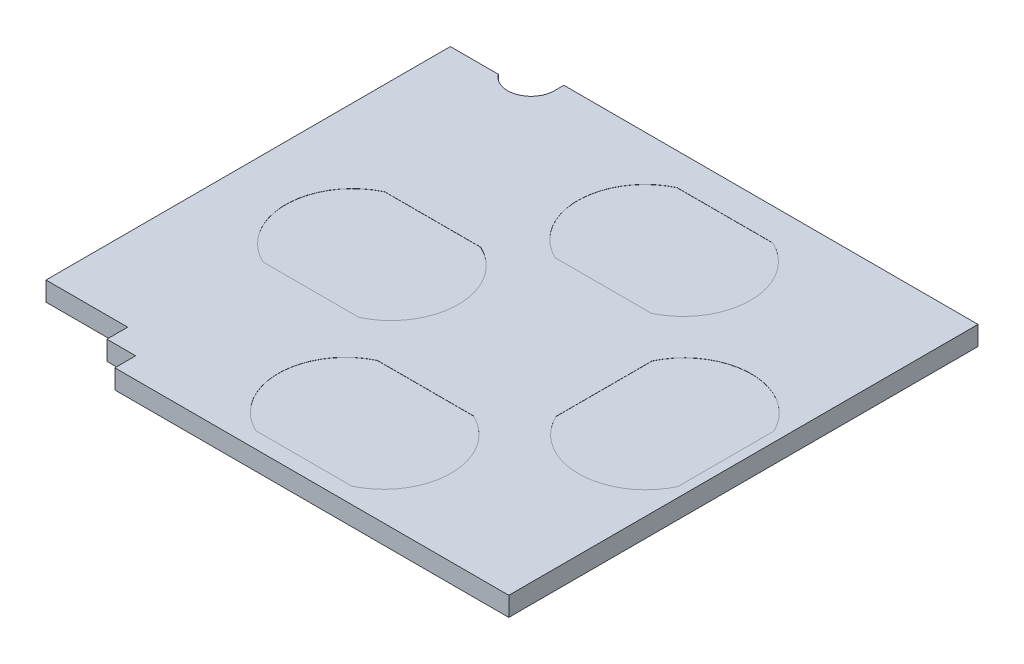
from build123d import *

# Parameters (mm, degrees)
BOSS_EXTRU_1_DEPTH      = 1.2
ENL_V_START             = -1.2
ENL_V_MAT_EXTRU_1_DEPTH = 1.2
ENL_V_MAT_EXTRU_2_DEPTH = 0.01


with BuildPart() as part:
    # Esquisse1 → Boss.-Extru.1 (new body)
    with BuildSketch(Plane(origin=(0, 0, 0), x_dir=(1, 0, 0), z_dir=(0, 1, 0))):
        with BuildLine():
            Line((-15.75, 11.9), (-12.75, 11.9))
            ThreePointArc((-12.75, 11.9), (-10.842060454, 11.495351769), (-10.238526329, 13.35))
            Line((-10.238526329, 13.35), (15.75, 13.35))
            Line((15.75, 13.35), (15.75, -15.95))
            Line((15.75, -15.95), (-8.85, -15.95))
            Line((-8.85, -15.95), (-8.85, -14.65))
            Line((-8.85, -14.65), (-10.65, -14.65))
            Line((-10.65, -14.65), (-10.65, -13.35))
            Line((-10.65, -13.35), (-15.75, -13.35))
            Line((-15.75, -13.35), (-15.75, 11.9))
        make_face()
    extrude(amount=BOSS_EXTRU_1_DEPTH)

    # Esquisse3 → Enlèv. mat.-Extru.1 (cut)
    with BuildSketch(Plane(origin=(0, 1.2, 0), x_dir=(1, 0, 0), z_dir=(0, 1, 0)).offset(ENL_V_START)):
        with BuildLine():
            Line((-10.112997726, 12.758125458), (-10.112997726, 13.35))
            Line((-10.112997726, 13.35), (-10.238526329, 13.35))
            ThreePointArc((-10.238526329, 13.35), (-10.144725054, 13.060645252), (-10.112997726, 12.758125458))
        make_face()
    extrude(amount=ENL_V_MAT_EXTRU_1_DEPTH, mode=Mode.SUBTRACT)

    # Esquisse4 → Enlèv. mat.-Extru.2 (cut)
    with BuildSketch(Plane(origin=(0, 1.2, 0), x_dir=(1, 0, 0), z_dir=(0, 1, 0))):
        with BuildLine():
            Line((-1.05, 11.35), (4.95, 11.35))
            ThreePointArc((4.95, 11.35), (7.35, 7.55), (4.95, 3.75))
            Line((4.95, 3.75), (-1.05, 3.75))
            ThreePointArc((-1.05, 3.75), (-3.45, 7.55), (-1.05, 11.35))
        make_face()
        with BuildLine():
            Line((-1.05, -7.35), (4.95, -7.35))
            ThreePointArc((4.95, -7.35), (7.35, -11.15), (4.95, -14.95))
            Line((4.95, -14.95), (-1.05, -14.95))
            ThreePointArc((-1.05, -14.95), (-3.45, -11.15), (-1.05, -7.35))
        make_face()
        with BuildLine():
            Line((-9.95, 2), (-3.95, 2))
            ThreePointArc((-3.95, 2), (-1.55, -1.8), (-3.95, -5.6))
            Line((-3.95, -5.6), (-9.95, -5.6))
            ThreePointArc((-9.95, -5.6), (-12.35, -1.8), (-9.95, 2))
        make_face()
        with BuildLine():
            Line((7.55, 1.2), (7.55, -4.8))
            ThreePointArc((7.55, -4.8), (11.35, -7.2), (15.15, -4.8))
            Line((15.15, -4.8), (15.15, 1.2))
            ThreePointArc((15.15, 1.2), (11.35, 3.6), (7.55, 1.2))
        make_face()
    extrude(amount=-ENL_V_MAT_EXTRU_2_DEPTH, mode=Mode.SUBTRACT)


solid = part.part
